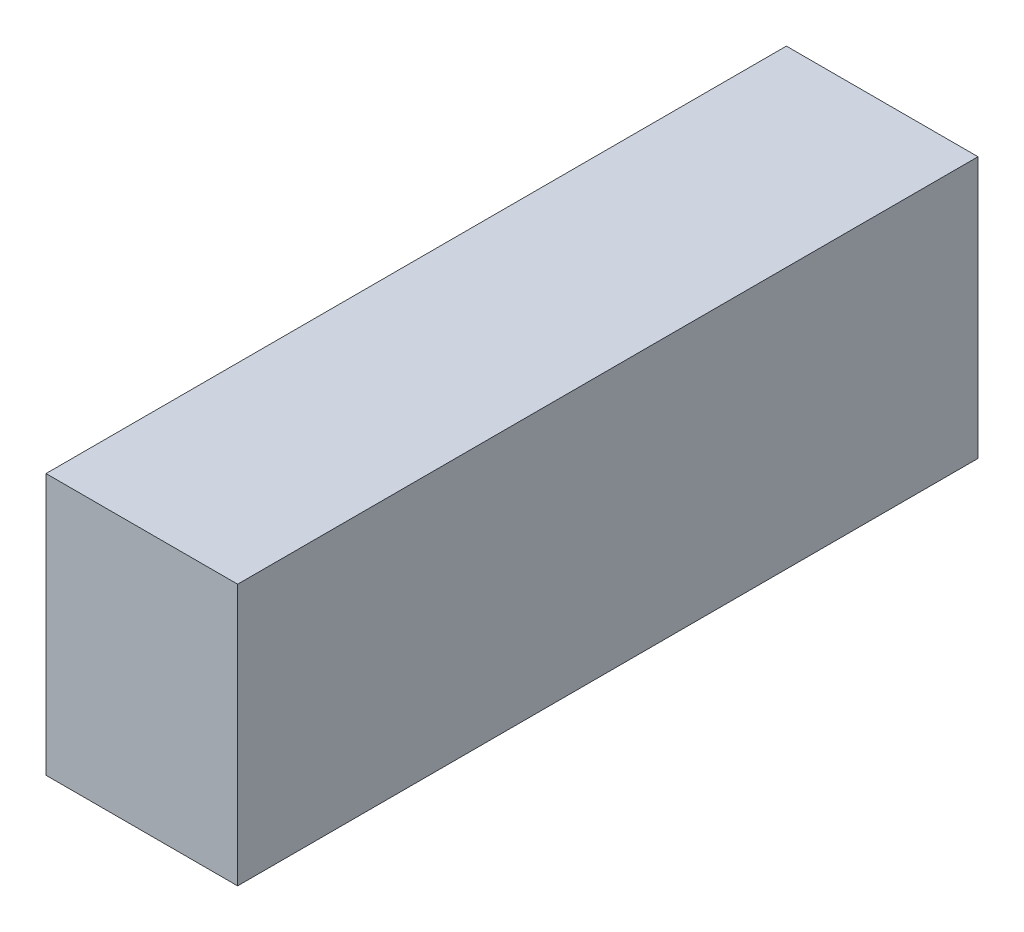
from build123d import *

# Parameters (mm, degrees)
SKETCH1_W           = 27.94
SKETCH1_H           = 38.1
BOSS_EXTRUDE1_DEPTH = 31.75
SKETCH2_W           = 27.94
SKETCH2_H           = 38.1
BOSS_EXTRUDE2_DEPTH = 76.2


with BuildPart() as part:
    # Sketch1 → Boss-Extrude1 (new body)
    with BuildSketch(Plane.XY):
        Rectangle(SKETCH1_W, SKETCH1_H)
    extrude(amount=BOSS_EXTRUDE1_DEPTH)

    # Sketch2 → Boss-Extrude2 (add)
    with BuildSketch(Plane(origin=(0, 0, 0), x_dir=(-1, 0, 0), z_dir=(0, 0, -1))):
        Rectangle(SKETCH2_W, SKETCH2_H)
    extrude(amount=BOSS_EXTRUDE2_DEPTH)


solid = part.part
